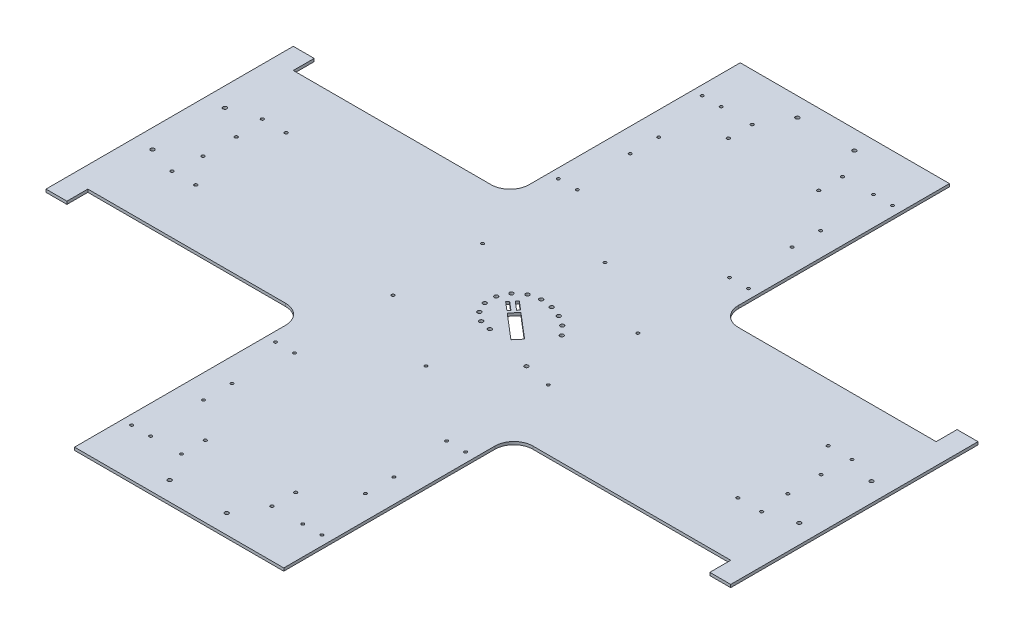
from build123d import *

# Parameters (mm, degrees)
BOSS_EXTRUDE1_DEPTH = 3
SKETCH2_R           = 1.6
CUT_EXTRUDE1_DEPTH  = 503.104570782
SKETCH3_R           = 2
CUT_EXTRUDE2_DEPTH  = 503.104570782
SKETCH4_R           = 2
SKETCH4_R_2         = 1.5
CUT_EXTRUDE3_DEPTH  = 10
SKETCH5_R           = 1.5
CUT_EXTRUDE4_DEPTH  = 10
FILLET1_R           = 20


with BuildPart() as part:
    # Sketch1 → Boss-Extrude1 (new body)
    with BuildSketch(Plane(origin=(0, 0, 0), x_dir=(1, 0, 0), z_dir=(0, 1, 0))):
        Polygon((-110, 350), (-110, 108), (-338, 108), (-338, 130), (-360, 130), (-360, -130), (-338, -130), (-338, -108), (-110, -108), (-110, -350), (110, -350), (110, -108), (338, -108), (338, -130), (360, -130), (360, 130), (338, 130), (338, 108), (110, 108), (110, 350), align=None)
    extrude(amount=BOSS_EXTRUDE1_DEPTH)

    # Sketch2 → Cut-Extrude1 (cut, through all)
    with BuildSketch(Plane(origin=(0, 3, 0), x_dir=(1, 0, 0), z_dir=(0, 1, 0))):
        with Locations(Location((310, 47.5, 0), (0, 0, 270))):
            Circle(SKETCH2_R)
        with Locations(Location((285, 47.5, 0), (0, 0, 270))):
            Circle(SKETCH2_R)
        with Locations(Location((307.5, 17.5, 0), (0, 0, 270))):
            Circle(SKETCH2_R)
        with Locations(Location((307.5, -17.5, 0), (0, 0, 270))):
            Circle(SKETCH2_R)
        with Locations(Location((310, -47.5, 0), (0, 0, 270))):
            Circle(SKETCH2_R)
        with Locations(Location((285, -47.5, 0), (0, 0, 270))):
            Circle(SKETCH2_R)
        with Locations(Location((-285, -47.5, 0), (0, 0, 90))):
            Circle(SKETCH2_R)
        with Locations(Location((-310, -47.5, 0), (0, 0, 90))):
            Circle(SKETCH2_R)
        with Locations(Location((-307.5, -17.5, 0), (0, 0, 90))):
            Circle(SKETCH2_R)
        with Locations(Location((-307.5, 17.5, 0), (0, 0, 90))):
            Circle(SKETCH2_R)
        with Locations(Location((-285, 47.5, 0), (0, 0, 90))):
            Circle(SKETCH2_R)
        with Locations(Location((-310, 47.5, 0), (0, 0, 90))):
            Circle(SKETCH2_R)
        with Locations(Location((47.5, 300, 0), (0, 0, 270))):
            Circle(SKETCH2_R)
        with Locations(Location((47.5, 275, 0), (0, 0, 270))):
            Circle(SKETCH2_R)
        with Locations(Location((-47.5, 275, 0), (0, 0, 90))):
            Circle(SKETCH2_R)
        with Locations(Location((-47.5, 300, 0), (0, 0, 90))):
            Circle(SKETCH2_R)
        with Locations(Location((-47.5, -300, 0), (0, 0, 270))):
            Circle(SKETCH2_R)
        with Locations(Location((-47.5, -275, 0), (0, 0, 270))):
            Circle(SKETCH2_R)
        with Locations(Location((47.5, -275, 0), (0, 0, 90))):
            Circle(SKETCH2_R)
        with Locations(Location((47.5, -300, 0), (0, 0, 90))):
            Circle(SKETCH2_R)
    extrude(amount=-CUT_EXTRUDE1_DEPTH, mode=Mode.SUBTRACT)

    # Sketch3 → Cut-Extrude2 (cut, through all)
    with BuildSketch(Plane(origin=(0, 3, 0), x_dir=(1, 0, 0), z_dir=(0, 1, 0))):
        with Locations(Location((340, 38, 0), (0, 0, 270))):
            Circle(SKETCH3_R)
        with Locations(Location((340, -38, 0), (0, 0, 90))):
            Circle(SKETCH3_R)
        with Locations(Location((-340, -38, 0), (0, 0, 270))):
            Circle(SKETCH3_R)
        with Locations(Location((-340, 38, 0), (0, 0, 90))):
            Circle(SKETCH3_R)
        with Locations(Location((-30, 330, 0), (0, 0, 270))):
            Circle(SKETCH3_R)
        with Locations(Location((30, 330, 0), (0, 0, 90))):
            Circle(SKETCH3_R)
        with Locations(Location((30, -330, 0), (0, 0, 270))):
            Circle(SKETCH3_R)
        with Locations(Location((-30, -330, 0), (0, 0, 90))):
            Circle(SKETCH3_R)
    extrude(amount=-CUT_EXTRUDE2_DEPTH, mode=Mode.SUBTRACT)

    # Sketch4 → Cut-Extrude3 (cut)
    with BuildSketch(Plane(origin=(0, 3, 0), x_dir=(1, 0, 0), z_dir=(0, 1, 0))):
        with Locations(Location((0.808520266, 29.830132062, 0), (0, 0, 270))):
            Circle(SKETCH4_R)
        with Locations(Location((13.346143391, 28.330403085, 0), (0, 0, 270))):
            Circle(SKETCH4_R)
        with Locations(Location((25.203013099, 23.988074058, 0), (0, 0, 270))):
            Circle(SKETCH4_R)
        with Locations(Location((35.760220631, 17.060841581, 0), (0, 0, 270))):
            Circle(SKETCH4_R)
        with Locations(Location((44.463500299, 7.912393424, 0), (0, 0, 270))):
            Circle(SKETCH4_R)
        with Locations(Location((53.928254969, -38.753193613, 0), (0, 0, 270))):
            Circle(SKETCH4_R)
        with Locations(Location((-10.859337922, 27.178870948, 0), (0, 0, 270))):
            Circle(SKETCH4_R)
        with Locations(Location((-20.281408497, 19.688806529, 0), (0, 0, 270))):
            Circle(SKETCH4_R)
        with Locations(Location((-25.512210732, 8.848364338, 0), (0, 0, 270))):
            Circle(SKETCH4_R)
        with Locations(Location((-25.512210732, -3.188100214, 0), (0, 0, 270))):
            Circle(SKETCH4_R)
        with Locations(Location((-20.281408497, -14.028542405, 0), (0, 0, 270))):
            Circle(SKETCH4_R)
        with Locations(Location((-10.859337922, -21.518606823, 0), (0, 0, 270))):
            Circle(SKETCH4_R)
        with Locations(Location((0.881523066, -24.169769245, 0), (0, 0, 270))):
            Circle(SKETCH4_R)
        with Locations(Location((0.808520266, 97.080132062, 0), (0, 0, 270))):
            Circle(SKETCH4_R_2)
        with Locations(Location((82.431414572, 49.955132062, 0), (0, 0, 270))):
            Circle(SKETCH4_R_2)
        with Locations(Location((82.431414572, -44.294867938, 0), (0, 0, 270))):
            Circle(SKETCH4_R_2)
        with Locations(Location((0.808520266, -91.419867938, 0), (0, 0, 270))):
            Circle(SKETCH4_R_2)
        with Locations(Location((-80.814374041, -44.294867938, 0), (0, 0, 270))):
            Circle(SKETCH4_R_2)
        with Locations(Location((-80.814374041, 49.955132062, 0), (0, 0, 270))):
            Circle(SKETCH4_R_2)
        Polygon((-4.591750043, -0.423359002), (21.666877407, -22.800456322), (28.282714875, -15.037036032), (2.024087426, 7.340061288), align=None)
        Polygon((-6.875108951, 1.522475548), (-4.929274402, 3.805834456), (-14.062710037, 11.589172655), (-16.008544586, 9.305813746), align=None)
        Polygon((-2.205106032, 7.002536929), (-0.259271483, 9.285895837), (-9.392707118, 17.069234035), (-11.338541667, 14.785875127), align=None)
    extrude(amount=-CUT_EXTRUDE3_DEPTH, mode=Mode.SUBTRACT)

    # Sketch5 → Cut-Extrude4 (cut)
    with BuildSketch(Plane(origin=(0, 3, 0), x_dir=(1, 0, 0), z_dir=(0, 1, 0))):
        with Locations(Location((80, 300, 0), (0, 0, 270))):
            Circle(SKETCH5_R)
        with Locations(Location((80, 148.73, 0), (0, 0, 270))):
            Circle(SKETCH5_R)
        with Locations(Location((85.11, 239.365, 0), (0, 0, 270))):
            Circle(SKETCH5_R)
        with Locations(Location((85.11, 209.365, 0), (0, 0, 270))):
            Circle(SKETCH5_R)
        with Locations(Location((100, 148.73, 0), (0, 0, 90))):
            Circle(SKETCH5_R)
        with Locations(Location((100, 300, 0), (0, 0, 90))):
            Circle(SKETCH5_R)
        with Locations(Location((-100, 300, 0), (0, 0, 270))):
            Circle(SKETCH5_R)
        with Locations(Location((-100, 148.73, 0), (0, 0, 270))):
            Circle(SKETCH5_R)
        with Locations(Location((-85.11, 209.365, 0), (0, 0, 90))):
            Circle(SKETCH5_R)
        with Locations(Location((-85.11, 239.365, 0), (0, 0, 90))):
            Circle(SKETCH5_R)
        with Locations(Location((-80, 148.73, 0), (0, 0, 90))):
            Circle(SKETCH5_R)
        with Locations(Location((-80, 300, 0), (0, 0, 90))):
            Circle(SKETCH5_R)
        with Locations(Location((-80, -300, 0), (0, 0, 270))):
            Circle(SKETCH5_R)
        with Locations(Location((-80, -148.73, 0), (0, 0, 270))):
            Circle(SKETCH5_R)
        with Locations(Location((-85.11, -239.365, 0), (0, 0, 270))):
            Circle(SKETCH5_R)
        with Locations(Location((-85.11, -209.365, 0), (0, 0, 270))):
            Circle(SKETCH5_R)
        with Locations(Location((-100, -148.73, 0), (0, 0, 90))):
            Circle(SKETCH5_R)
        with Locations(Location((-100, -300, 0), (0, 0, 90))):
            Circle(SKETCH5_R)
        with Locations(Location((100, -300, 0), (0, 0, 270))):
            Circle(SKETCH5_R)
        with Locations(Location((100, -148.73, 0), (0, 0, 270))):
            Circle(SKETCH5_R)
        with Locations(Location((85.11, -209.365, 0), (0, 0, 90))):
            Circle(SKETCH5_R)
        with Locations(Location((85.11, -239.365, 0), (0, 0, 90))):
            Circle(SKETCH5_R)
        with Locations(Location((80, -148.73, 0), (0, 0, 90))):
            Circle(SKETCH5_R)
        with Locations(Location((80, -300, 0), (0, 0, 90))):
            Circle(SKETCH5_R)
    extrude(amount=-CUT_EXTRUDE4_DEPTH, mode=Mode.SUBTRACT)

    # Fillet1
    fillet1_edges = [part.edges().sort_by_distance(p)[0] for p in [
        (110, 1.5, -108),
        (110, 1.5, 108),
        (-110, 1.5, 108),
        (-110, 1.5, -108),
    ]]
    fillet(fillet1_edges, radius=FILLET1_R)


solid = part.part
